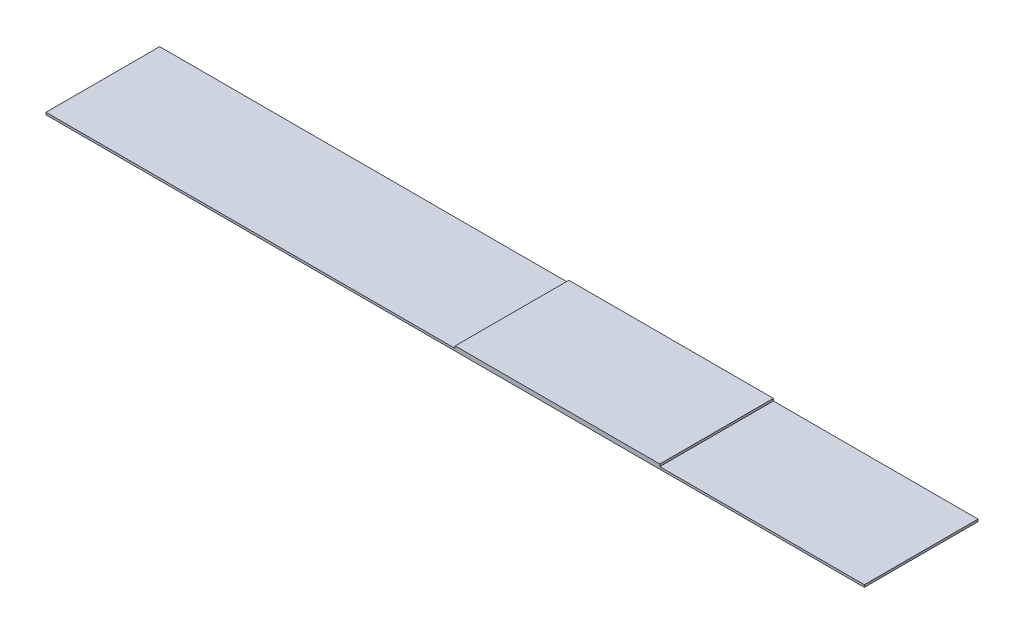
from build123d import *

# Parameters (mm, degrees)
SKETCH1_W           = 36
SKETCH1_H           = 5
BOSS_EXTRUDE1_DEPTH = 0.1
SKETCH2_W           = 9
SKETCH2_H           = 5
BOSS_EXTRUDE2_DEPTH = 0.1


with BuildPart() as part:
    # Sketch1 → Boss-Extrude1 (new body)
    with BuildSketch(Plane(origin=(0, 0, 0), x_dir=(1, 0, 0), z_dir=(0, 1, 0))):
        Rectangle(SKETCH1_W, SKETCH1_H)
    extrude(amount=BOSS_EXTRUDE1_DEPTH)

    # Sketch2 → Boss-Extrude2 (add)
    with BuildSketch(Plane(origin=(0, 0.1, 0), x_dir=(1, 0, 0), z_dir=(0, 1, 0))):
        with Locations((4.5, 0)):
            Rectangle(SKETCH2_W, SKETCH2_H)
    extrude(amount=BOSS_EXTRUDE2_DEPTH)


solid = part.part
